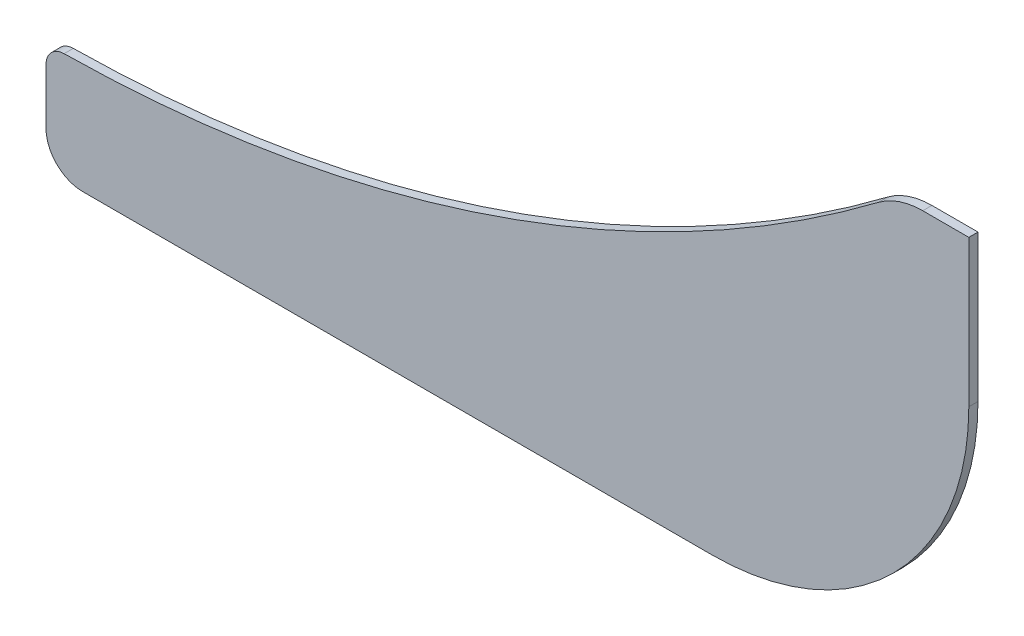
from build123d import *

# Parameters (mm, degrees)
BOSS_EXTRUDE1_DEPTH = 6.35
FILLET1_R           = 12.7


with BuildPart() as part:
    # Sketch1 → Boss-Extrude1 (new body)
    with BuildSketch(Plane.XY):
        with BuildLine():
            Line((-76.2, -210.82), (-76.2, -261.62))
            ThreePointArc((-76.2, -261.62), (-68.760512242, -279.580512242), (-50.8, -287.02))
            Line((-50.8, -287.02), (385.048811446, -287.02))
            ThreePointArc((385.048811446, -287.02), (510.772397141, -234.943585695), (562.848811446, -109.22))
            Line((562.848811446, -109.22), (562.848811446, -7.62))
            Line((562.848811446, -7.62), (530.929220686, -7.62))
            ThreePointArc((530.929220686, -7.62), (514.80604796, -10.246529072), (500.350118615, -17.8545157))
            ThreePointArc((500.350118615, -17.8545157), (227.792482393, -161.298413505), (-76.2, -210.82))
        make_face()
    extrude(amount=BOSS_EXTRUDE1_DEPTH)

    # Fillet1
    fillet1_edges = [part.edges().sort_by_distance(p)[0] for p in [
        (-76.2, -210.82, 3.175),
    ]]
    fillet(fillet1_edges, radius=FILLET1_R)


solid = part.part
